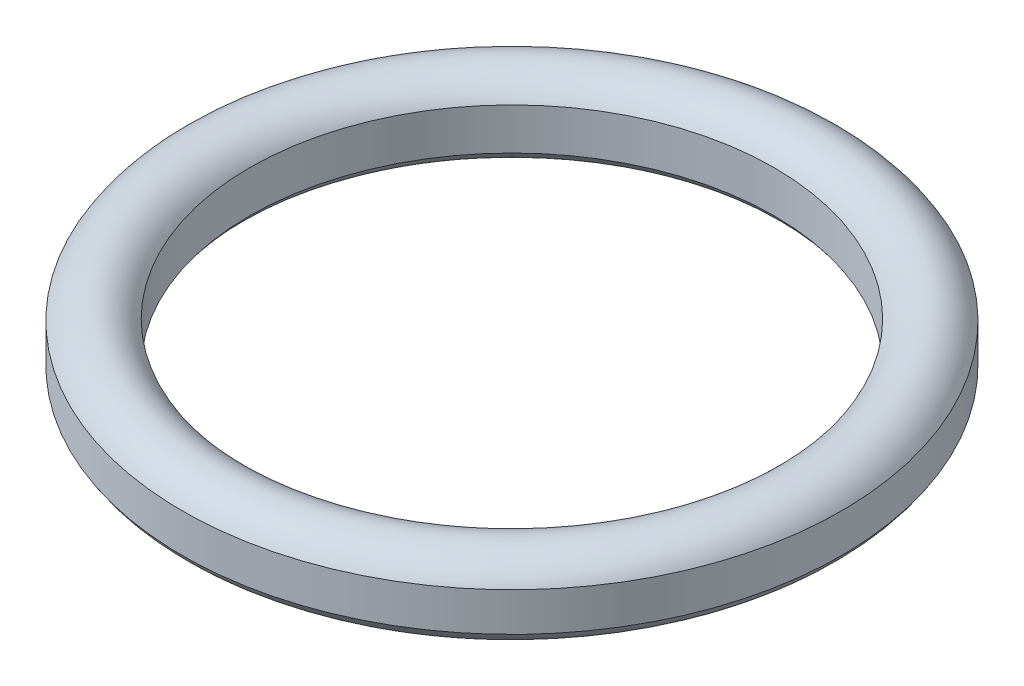
from build123d import *


with BuildPart() as part:
    # Schizzo1 → Rivoluzione1 (revolve)
    with BuildSketch(Plane.XY, mode=Mode.PRIVATE) as rivoluzione1_sk:
        with BuildLine():
            ThreePointArc((-11, -0.645368112), (-9.889297646, -1.309672344), (-8.75, -0.695701085))
            Line((-8.75, -0.695701085), (-8.75, 0.695701085))
            ThreePointArc((-8.75, 0.695701085), (-9.889297646, 1.309672344), (-11, 0.645368112))
            Line((-11, 0.645368112), (-11, -0.645368112))
        make_face()
    revolve(rivoluzione1_sk.sketch.rotate(Axis((0, 0, 0), (0, 1, 0)), 270), axis=Axis((0, 0, 0), (0, 1, 0)))


solid = part.part
